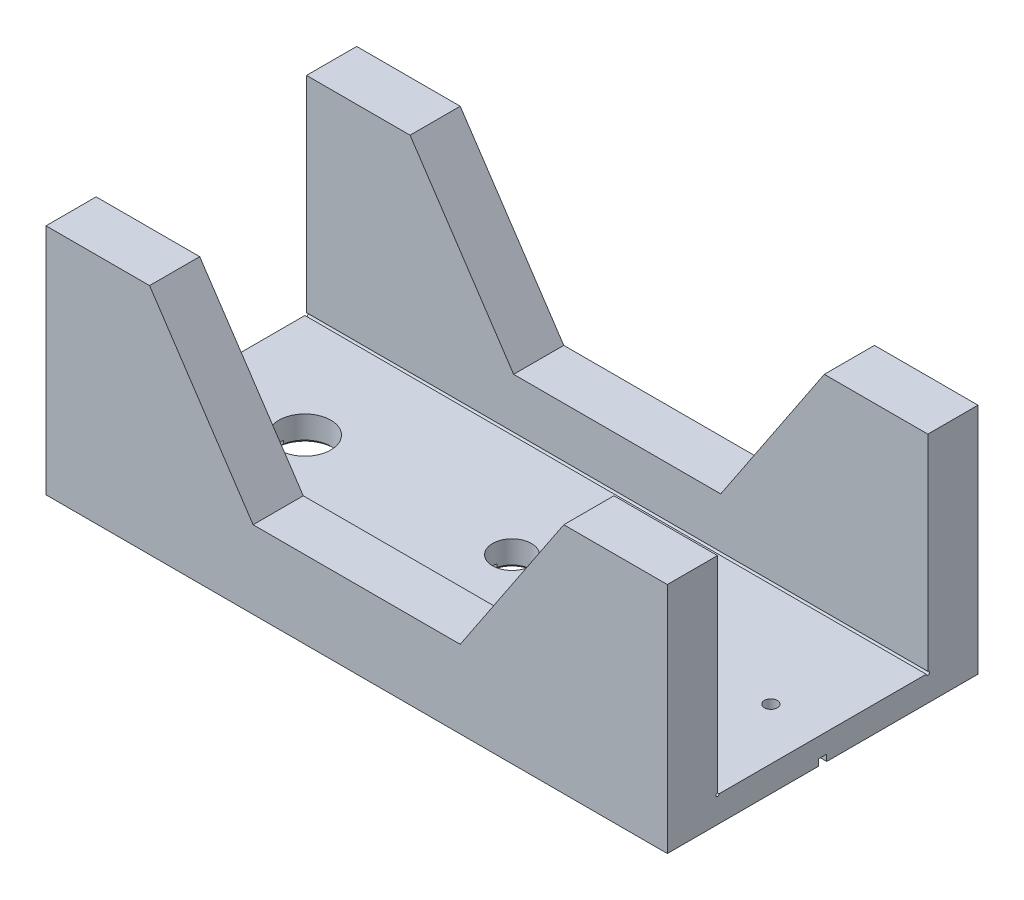
from build123d import *

# Parameters (mm, degrees)
SKETCH2_W             = 76.2
SKETCH2_H             = 6.15
BOSS_EXTRUDE1_DEPTH   = 28.575
BOSS_EXTRUDE1_2_DEPTH = 28.575
SKETCH2_3_W           = 76.2
SKETCH2_3_H           = 25.8
BOSS_EXTRUDE2_DEPTH   = 3.175
CUT_EXTRUDE2_DEPTH    = 90.858670283
SKETCH4_R             = 3.175
SKETCH4_R_2           = 2.38125
SKETCH4_R_3           = 1.5875
SKETCH4_R_4           = 0.79375
CUT_EXTRUDE3_DEPTH    = 90.858670283
SKETCH5_R             = 0.2
CUT_EXTRUDE4_DEPTH    = 90.858670283
CHAMFER1_SIZE         = 0.4
SKETCH6_W             = 76.2
SKETCH6_H             = 1
CUT_EXTRUDE5_DEPTH    = 0.79375


with BuildPart() as part:
    # Sketch2 → Boss-Extrude1 (new body)
    with BuildSketch(Plane(origin=(0, 0, 0), x_dir=(1, 0, 0), z_dir=(0, 1, 0))):
        with Locations((-38.1, 3.075)):
            Rectangle(SKETCH2_W, SKETCH2_H)
    extrude(amount=BOSS_EXTRUDE1_DEPTH)



with BuildPart() as body_2:
    # Sketch2 → Boss-Extrude1 2 (new body)
    with BuildSketch(Plane(origin=(0, 0, 0), x_dir=(1, 0, 0), z_dir=(0, 1, 0))):
        with Locations((-38.1, 35.025)):
            Rectangle(SKETCH2_W, SKETCH2_H)
    extrude(amount=BOSS_EXTRUDE1_2_DEPTH)


with BuildPart() as part_1:
    add(part.part)

    add(body_2.part)  # Boss-Extrude2 merges body 2
    # Sketch2<3> → Boss-Extrude2 (add)
    with BuildSketch(Plane(origin=(0, 0, 0), x_dir=(1, 0, 0), z_dir=(0, 1, 0))):
        with Locations((-38.1, 19.05)):
            Rectangle(SKETCH2_3_W, SKETCH2_3_H)
    extrude(amount=BOSS_EXTRUDE2_DEPTH)

    # Sketch3 → Cut-Extrude2 (cut, through all)
    with BuildSketch(Plane.XY):
        Polygon((-12.7, 28.575), (-63.5, 28.575), (-50.8, 9.525), (-25.4, 9.525), align=None)
    extrude(amount=-CUT_EXTRUDE2_DEPTH, mode=Mode.SUBTRACT)

    # Sketch4 → Cut-Extrude3 (cut, through all)
    with BuildSketch(Plane.XZ):
        with Locations((-63.5, -19.05)):
            Circle(SKETCH4_R)
        with Locations((-38.1, -19.05)):
            Circle(SKETCH4_R_2)
        with Locations((-19.05, -19.05)):
            Circle(SKETCH4_R_3)
        with Locations((-6.35, -19.05)):
            Circle(SKETCH4_R_4)
    extrude(amount=-CUT_EXTRUDE3_DEPTH, mode=Mode.SUBTRACT)

    # Sketch5 → Cut-Extrude4 (cut, through all)
    with BuildSketch(Plane(origin=(0, 0, 0), x_dir=(0, 0, -1), z_dir=(1, 0, 0))):
        with Locations((6.15, 3.175)):
            Circle(SKETCH5_R)
        with Locations((31.95, 3.175)):
            Circle(SKETCH5_R)
    extrude(amount=-CUT_EXTRUDE4_DEPTH, mode=Mode.SUBTRACT)

    # Chamfer1
    chamfer1_edges = [part_1.edges().sort_by_distance(p)[0] for p in [
        (-7.14375, 0, -19.05),
        (-20.6375, 0, -19.05),
        (-40.48125, 0, -19.05),
        (-66.675, 0, -19.05),
    ]]
    chamfer(chamfer1_edges, length=CHAMFER1_SIZE)

    # Sketch6 → Cut-Extrude5 (cut)
    with BuildSketch(Plane(origin=(0, 0, 0), x_dir=(-1, 0, 0), z_dir=(0, -1, 0))):
        with Locations((38.1, 19.05)):
            Rectangle(SKETCH6_W, SKETCH6_H)
    extrude(amount=-CUT_EXTRUDE5_DEPTH, mode=Mode.SUBTRACT)


solid = part_1.part
